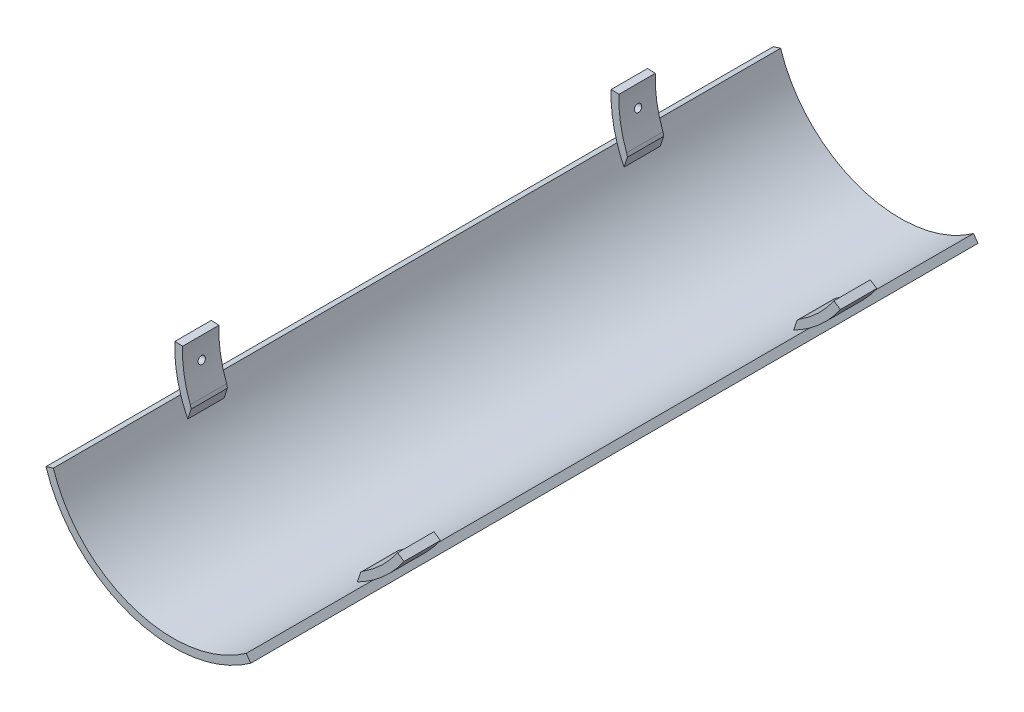
from build123d import *

# Parameters (mm, degrees)
EXTRUDE_1_DEPTH     = 150
EXTRUDE_START       = -247.5
EXTRUDE_2_DEPTH     = 247.5
CUT_EXTRUDE_START   = -52.5
SKETCH_3_R          = 51.8
CUT_EXTRUDE_1_DEPTH = 52.5
SKETCH_4_R          = 51.8
CUT_EXTRUDE_2_DEPTH = 82.5
SKETCH_6_R          = 1.5
CUT_EXTRUDE_3_DEPTH = 165
SKETCH_7_R          = 1.5
CUT_EXTRUDE_4_DEPTH = 165


with BuildPart() as part:
    # 草图1 → 凸台-拉伸1 (new, symmetric)
    with BuildSketch(Plane.XY):
        with BuildLine():
            Line((-52.413174316, -16.669107897), (-49.363680538, -15.699268892))
            ThreePointArc((-49.363680538, -15.699268892), (-16.314268086, -49.163855187), (30.185108172, -42.096309157))
            Line((30.185108172, -42.096309157), (32.049825279, -44.696853352))
            ThreePointArc((32.049825279, -44.696853352), (-17.322099319, -52.201004542), (-52.413174316, -16.669107897))
        make_face()
    extrude(amount=EXTRUDE_1_DEPTH, both=True)

    # 草图2 → 凸台-拉伸2 (add)
    with BuildSketch(Plane(origin=(0, 0, -150), x_dir=(-1, 0, 0), z_dir=(0, 0, -1)).offset(EXTRUDE_START)):
        with BuildLine():
            Line((-24.924043095, -42.002946324), (-23.507517235, -46.158819671))
            ThreePointArc((-23.507517235, -46.158819671), (-34.198599667, -38.906243468), (-42.762509098, -29.233676054))
            Line((-42.762509098, -29.233676054), (-40.120809695, -27.427734676))
            ThreePointArc((-40.120809695, -27.427734676), (-33.774000748, -34.946772003), (-26.042778843, -41.033323898))
            ThreePointArc((-26.042778843, -41.033323898), (-25.447325167, -41.476499857), (-24.924043095, -42.002946324))
        make_face()
        with BuildLine():
            Line((48.558861257, 1.99924822), (51.756152533, 2.130885963))
            ThreePointArc((51.756152533, 2.130885963), (50.673816706, -10.742639362), (46.439539695, -22.947966205))
            Line((46.439539695, -22.947966205), (45.090508335, -18.769695848))
            ThreePointArc((45.090508335, -18.769695848), (45.195249795, -18.034849445), (45.40762753, -17.323607076))
            ThreePointArc((45.40762753, -17.323607076), (47.966326083, -7.822503569), (48.558861257, 1.99924822))
        make_face()
    extrude(amount=EXTRUDE_2_DEPTH)

    # 草图3 → 切除-拉伸1 (cut)
    with BuildSketch(Plane(origin=(0, 0, -150), x_dir=(-1, 0, 0), z_dir=(0, 0, -1)).offset(CUT_EXTRUDE_START)):
        Circle(SKETCH_3_R)
    extrude(amount=CUT_EXTRUDE_1_DEPTH, mode=Mode.SUBTRACT)

    # 草图4 → 切除-拉伸2 (cut, symmetric)
    with BuildSketch(Plane.XY):
        Circle(SKETCH_4_R)
    extrude(amount=CUT_EXTRUDE_2_DEPTH, both=True, mode=Mode.SUBTRACT)

    # 草图6 → 切除-拉伸3 (cut)
    with BuildSketch(Plane(origin=(0, 0, 0), x_dir=(-0.6991347993064156, -0.7149898827247683, 0), z_dir=(0.7149898827247683, -0.6991347993064156, 0))):
        with Locations((0, 90)):
            Circle(SKETCH_6_R)
        with Locations((0, -90)):
            Circle(SKETCH_6_R)
    extrude(amount=CUT_EXTRUDE_3_DEPTH, mode=Mode.SUBTRACT)

    # 草图7 → 切除-拉伸4 (cut)
    with BuildSketch(Plane(origin=(0, 0, 0), x_dir=(0.13298935431462466, -0.991117466115384, 0), z_dir=(0.991117466115384, 0.13298935431462466, 0))):
        with Locations(Location((0, 90, 0), (0, 0, 180))):
            Circle(SKETCH_7_R)
        with Locations(Location((0, -90, 0), (0, 0, 180))):
            Circle(SKETCH_7_R)
    extrude(amount=-CUT_EXTRUDE_4_DEPTH, mode=Mode.SUBTRACT)


solid = part.part
